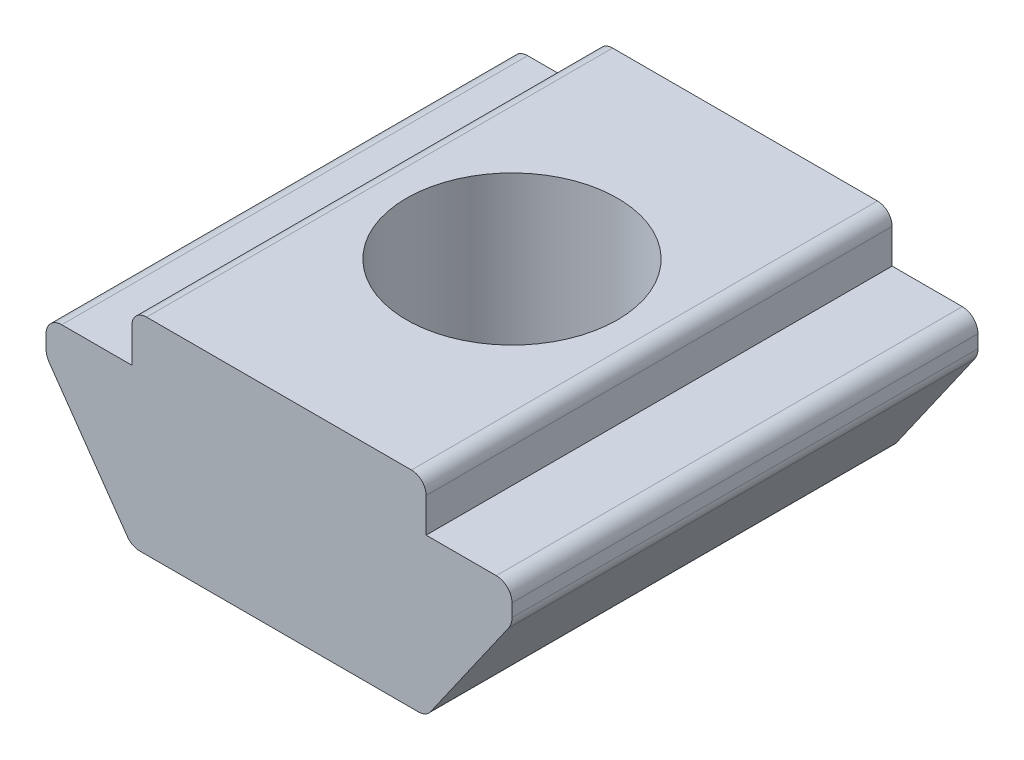
from build123d import *

# Parameters (mm, degrees)
EXTRUDE_2_DEPTH     = 9.5
CUT_EXTRUDE_2_REACH = 13.422
SKETCH_4_R          = 2.15


with BuildPart() as part:
    # 草图3 → 凸台-拉伸2 (new body)
    with BuildSketch(Plane.XY):
        with BuildLine():
            Line((-2.7, 0), (2.7, 0))
            ThreePointArc((2.7, 0), (2.912132034, -0.087867966), (3, -0.3))
            Line((3, -0.3), (3, -1))
            Line((3, -1), (4.43, -1))
            ThreePointArc((4.43, -1), (4.65627417, -1.09372583), (4.75, -1.32))
            Line((4.75, -1.32), (4.75, -1.582503942))
            ThreePointArc((4.75, -1.582503942), (4.732643857, -1.695268617), (4.682182017, -1.797595106))
            Line((4.682182017, -1.797595106), (3.089575498, -4.072072931))
            ThreePointArc((3.089575498, -4.072072931), (2.982354469, -4.16610325), (2.843829885, -4.2))
            Line((2.843829885, -4.2), (-2.843829885, -4.2))
            ThreePointArc((-2.843829885, -4.2), (-2.982354469, -4.16610325), (-3.089575498, -4.072072931))
            Line((-3.089575498, -4.072072931), (-4.682182017, -1.797595106))
            ThreePointArc((-4.682182017, -1.797595106), (-4.732643857, -1.695268617), (-4.75, -1.582503942))
            Line((-4.75, -1.582503942), (-4.75, -1.32))
            ThreePointArc((-4.75, -1.32), (-4.65627417, -1.09372583), (-4.43, -1))
            Line((-4.43, -1), (-3, -1))
            Line((-3, -1), (-3, -0.3))
            ThreePointArc((-3, -0.3), (-2.912132034, -0.087867966), (-2.7, 0))
        make_face()
    extrude(amount=EXTRUDE_2_DEPTH)

    # 草图4 → 切除-拉伸2 (cut, up to next)
    with BuildSketch(Plane(origin=(0, 0, 0), x_dir=(1, 0, 0), z_dir=(0, 1, 0)), mode=Mode.PRIVATE) as cut_extrude_2_sk1:
        with Locations(Location((0, -4.75, 0), (0, 0, 180))):
            Circle(SKETCH_4_R)
    cut_extrude_2_tool1 = extrude(cut_extrude_2_sk1.sketch, amount=-CUT_EXTRUDE_2_REACH, mode=Mode.PRIVATE) & part.part
    add(cut_extrude_2_tool1.solids().sort_by_distance((0, 0, 4.75))[0], mode=Mode.SUBTRACT)


solid = part.part
